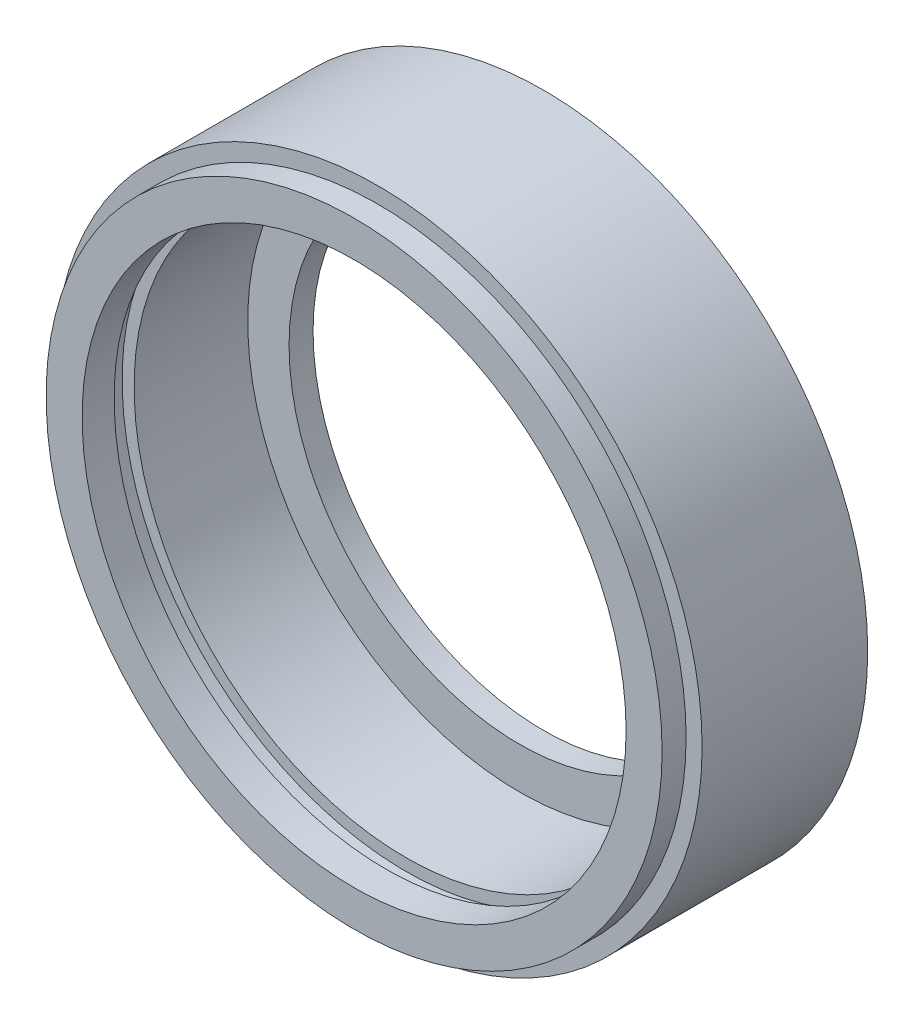
from build123d import *


with BuildPart() as part:
    # Эскиз1 → Повернуть1 (revolve)
    with BuildSketch(Plane(origin=(0, 0, 0), x_dir=(0, 0, -1), z_dir=(1, 0, 0)), mode=Mode.PRIVATE) as revolve_1_sk:
        Polygon((0, 28.833333333), (0, 40.5), (-20.7, 40.5), (-20.7, 38.5), (-23.7, 38.5), (-23.7, 34), (-19.7, 34), (-19.7, 35.5), (-17.2, 35.5), (-17.2, 34), (-3, 34), (-3, 28.833333333), align=None)
    revolve(revolve_1_sk.sketch.rotate(Axis((0, 0, 1010.5), (0, 0, -1)), 90), axis=Axis((0, 0, 1010.5), (0, 0, -1)))


solid = part.part
